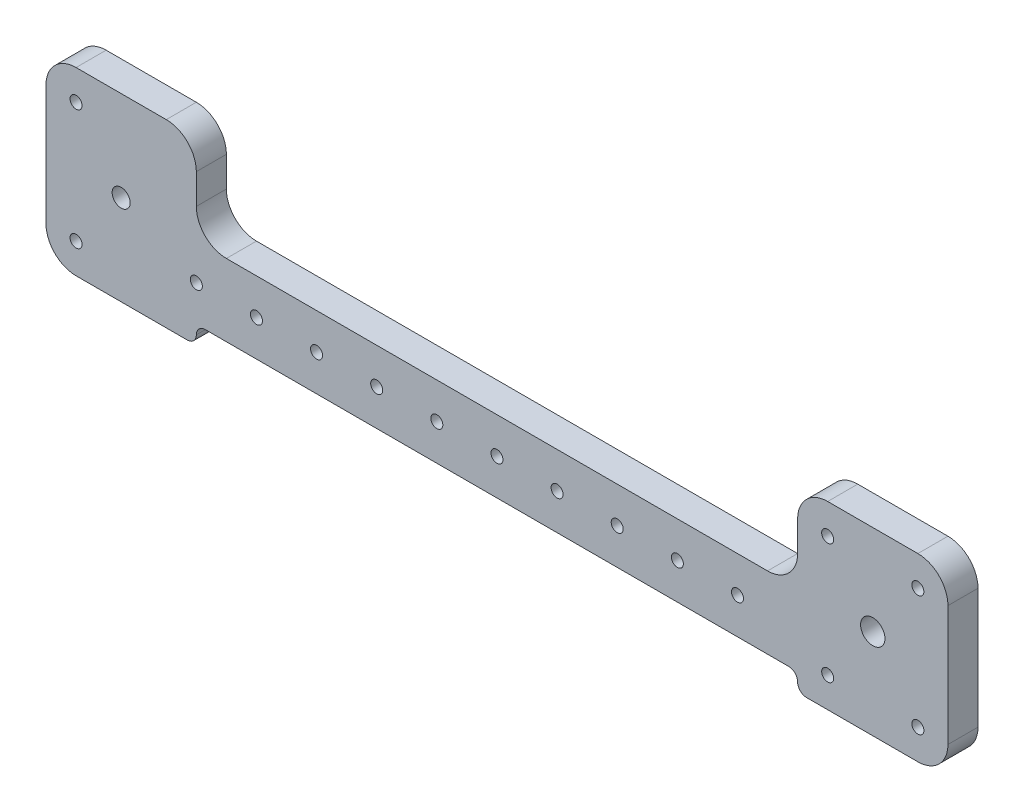
from build123d import *

# Parameters (mm, degrees)
MODEL_R             = 4.05
MODEL_R_2           = 3
MODEL_R_3           = 2
BOSS_EXTRUDE1_DEPTH = 10


with BuildPart() as part:
    # Model → Boss-Extrude1 (new body)
    with BuildSketch(Plane.XY):
        with BuildLine():
            Line((-90.089430894, 6), (103.910569106, 6))
            ThreePointArc((103.910569106, 6), (106.031889449, 5.121320344), (106.910569106, 3))
            ThreePointArc((106.910569106, 3), (107.789248762, 0.878679656), (109.910569106, 0))
            Line((109.910569106, 0), (146.910569106, 0))
            ThreePointArc((146.910569106, 0), (153.981636918, 2.928932188), (156.910569106, 10))
            Line((156.910569106, 10), (156.910569106, 50))
            ThreePointArc((156.910569106, 50), (153.981636918, 57.071067812), (146.910569106, 60))
            Line((146.910569106, 60), (116.910569106, 60))
            ThreePointArc((116.910569106, 60), (109.839501294, 57.071067812), (106.910569106, 50))
            Line((106.910569106, 50), (106.910569106, 40))
            ThreePointArc((106.910569106, 40), (103.981636918, 32.928932188), (96.910569106, 30))
            Line((96.910569106, 30), (-83.089430894, 30))
            ThreePointArc((-83.089430894, 30), (-90.160498706, 32.928932188), (-93.089430894, 40))
            Line((-93.089430894, 40), (-93.089430894, 50))
            ThreePointArc((-93.089430894, 50), (-96.018363082, 57.071067812), (-103.089430894, 60))
            Line((-103.089430894, 60), (-133.089430894, 60))
            ThreePointArc((-133.089430894, 60), (-140.160498706, 57.071067812), (-143.089430894, 50))
            Line((-143.089430894, 50), (-143.089430894, 10))
            ThreePointArc((-143.089430894, 10), (-140.160498706, 2.928932188), (-133.089430894, 0))
            Line((-133.089430894, 0), (-96.089430894, 0))
            ThreePointArc((-96.089430894, 0), (-93.968110551, 0.878679656), (-93.089430894, 3))
            ThreePointArc((-93.089430894, 3), (-92.210751238, 5.121320344), (-90.089430894, 6))
        make_face()
        with Locations((131.910569106, 30)):
            Circle(MODEL_R, mode=Mode.SUBTRACT)
        with Locations((-118.089430894, 30)):
            Circle(MODEL_R_2, mode=Mode.SUBTRACT)
        with Locations((6.910569106, 18)):
            Circle(MODEL_R_3, mode=Mode.SUBTRACT)
        with Locations((-33.089430894, 18)):
            Circle(MODEL_R_3, mode=Mode.SUBTRACT)
        with Locations((-13.089430894, 18)):
            Circle(MODEL_R_3, mode=Mode.SUBTRACT)
        with Locations((86.910569106, 18)):
            Circle(MODEL_R_3, mode=Mode.SUBTRACT)
        with Locations((66.910569106, 18)):
            Circle(MODEL_R_3, mode=Mode.SUBTRACT)
        with Locations((46.910569106, 18)):
            Circle(MODEL_R_3, mode=Mode.SUBTRACT)
        with Locations((26.910569106, 18)):
            Circle(MODEL_R_3, mode=Mode.SUBTRACT)
        with Locations((146.910569106, 10)):
            Circle(MODEL_R_3, mode=Mode.SUBTRACT)
        with Locations((146.910569106, 50)):
            Circle(MODEL_R_3, mode=Mode.SUBTRACT)
        with Locations((-133.089430894, 10)):
            Circle(MODEL_R_3, mode=Mode.SUBTRACT)
        with Locations((-133.089430894, 50)):
            Circle(MODEL_R_3, mode=Mode.SUBTRACT)
        with Locations((-93.089430894, 18)):
            Circle(MODEL_R_3, mode=Mode.SUBTRACT)
        with Locations((-73.089430894, 18)):
            Circle(MODEL_R_3, mode=Mode.SUBTRACT)
        with Locations((-53.089430894, 18)):
            Circle(MODEL_R_3, mode=Mode.SUBTRACT)
        with Locations((116.910569106, 50)):
            Circle(MODEL_R_3, mode=Mode.SUBTRACT)
        with Locations((116.910569106, 10)):
            Circle(MODEL_R_3, mode=Mode.SUBTRACT)
    extrude(amount=BOSS_EXTRUDE1_DEPTH)


solid = part.part
